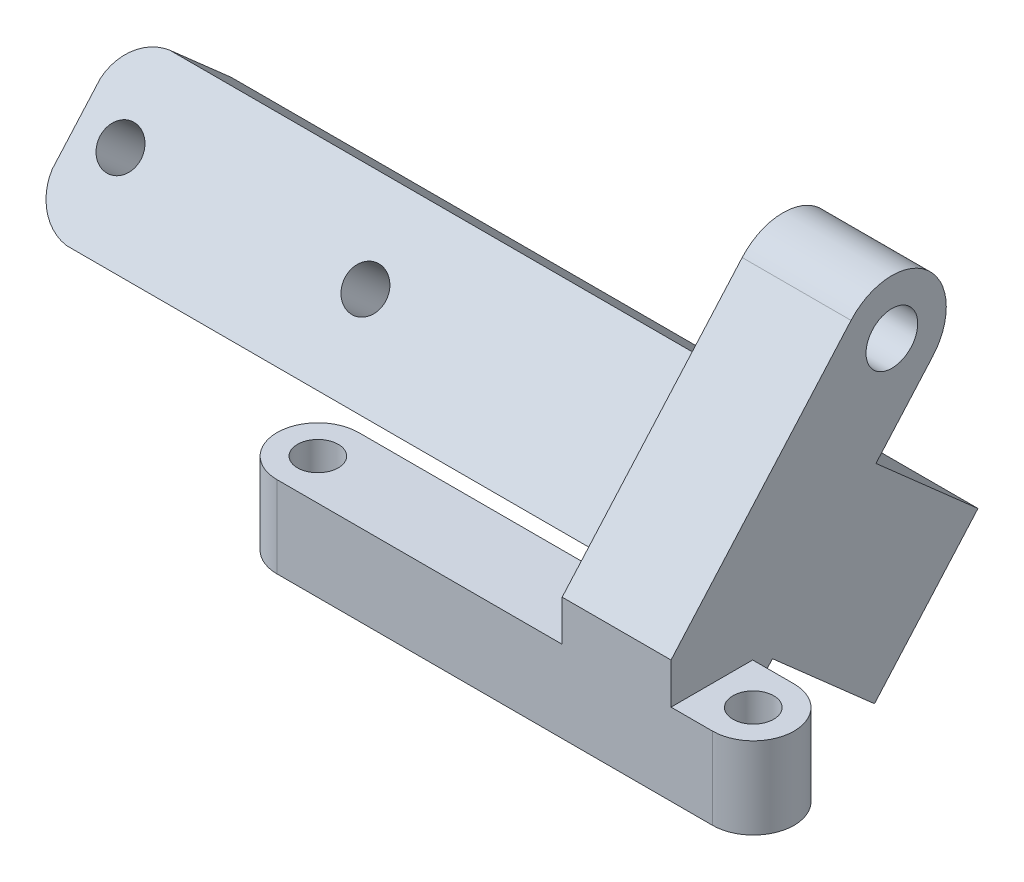
from build123d import *

# Parameters (mm, degrees)
SKETCH_1_R          = 1.5
EXTRUDE_2_DEPTH     = 6
SKETCH_1_4_W        = 8
SKETCH_1_4_H        = 6
EXTRUDE_3_DEPTH     = 3
EXTRUDE_28_DEPTH    = 8
SKETCH_4_W          = 7.960549586
SKETCH_4_H          = 11.5
EXTRUDE_29_DEPTH    = 10
EXTRUDE_30_DEPTH    = 50
SKETCH_7_R          = 1.5
CUT_EXTRUDE_1_DEPTH = 10
SKETCH_8_R          = 1.9
CUT_EXTRUDE_2_DEPTH = 19


with BuildPart() as part:
    # 草圖1 → 填料-伸長2 (new body)
    with BuildSketch(Plane(origin=(0, 0, 0), x_dir=(1, 0, 0), z_dir=(0, 1, 0))):
        with BuildLine():
            Line((-38.676968887, -3), (-6.676968887, -3))
            ThreePointArc((-6.676968887, -3), (-3.676968887, 0), (-6.676968887, 3))
            Line((-6.676968887, 3), (-38.676968887, 3))
            ThreePointArc((-38.676968887, 3), (-41.676968887, 0), (-38.676968887, -3))
        make_face()
        with Locations((-38.676968887, 0)):
            Circle(SKETCH_1_R, mode=Mode.SUBTRACT)
        with Locations((-6.676968887, 0)):
            Circle(SKETCH_1_R, mode=Mode.SUBTRACT)
    extrude(amount=-EXTRUDE_2_DEPTH)

    # 草圖1<4> → 填料-伸長3 (add)
    with BuildSketch(Plane(origin=(0, 0, 0), x_dir=(1, 0, 0), z_dir=(0, 1, 0))):
        with Locations((-13.722758256, 0)):
            Rectangle(SKETCH_1_4_W, SKETCH_1_4_H)
    extrude(amount=EXTRUDE_3_DEPTH)

    # 草圖3 → 填料-伸長28 (add)
    with BuildSketch(Plane(origin=(-9.722758256, 0, 0), x_dir=(0, 0, -1), z_dir=(1, 0, 0))):
        with BuildLine():
            Line((3, -2.291502622), (16.228756555, 12.708497378))
            ThreePointArc((16.228756555, 12.708497378), (15.874507866, 18.354248689), (10.228756555, 18))
            Line((10.228756555, 18), (-3, 3))
            Line((-3, 3), (3, -2.291502622))
        make_face()
    extrude(amount=-EXTRUDE_28_DEPTH)

    # 草圖4 → 填料-伸長29 (add)
    with BuildSketch(Plane(origin=(0, -2.49076751, -2.824264888), x_dir=(-1, 0, 0), z_dir=(0, -0.6614378277661491, -0.7499999999999987))):
        with Locations((13.703033049, 8.211179299)):
            Rectangle(SKETCH_4_W, SKETCH_4_H)
    extrude(amount=EXTRUDE_29_DEPTH)

    # 草圖6 → 填料-伸長30 (add)
    with BuildSketch(Plane.ZY.offset(17.683307842)):
        Polygon((-19.558716996, 1.365738687), (-11.952181977, -7.259261313), (-7.452181977, -3.290634347), (-15.058716996, 5.334365653), align=None)
    extrude(amount=EXTRUDE_30_DEPTH)

    # 草圖7 → 除料-伸長1 (cut)
    with BuildSketch(Plane(origin=(0, -9.105145787, -10.324264888), x_dir=(-1, 0, 0), z_dir=(0, -0.6614378277661491, -0.7499999999999987))):
        with BuildLine():
            Line((64.603588297, 2.461179299), (67.683307842, 2.461179299))
            Line((67.683307842, 2.461179299), (67.683307842, 5.540898844))
            ThreePointArc((67.683307842, 5.540898844), (66.684672199, 3.459814942), (64.603588297, 2.461179299))
        make_face()
        with Locations((64.480624333, 8.278010001)):
            Circle(SKETCH_7_R)
        with BuildLine():
            ThreePointArc((64.603588297, 13.961179299), (66.684672199, 12.962543656), (67.683307842, 10.881459754))
            Line((67.683307842, 10.881459754), (67.683307842, 13.961179299))
            Line((67.683307842, 13.961179299), (64.603588297, 13.961179299))
        make_face()
        with Locations((46.480624333, 8.278010001)):
            Circle(SKETCH_7_R)
    extrude(amount=-CUT_EXTRUDE_1_DEPTH, mode=Mode.SUBTRACT)

    # 草圖8 → 除料-伸長2 (cut)
    with BuildSketch(Plane(origin=(-9.722758256, 0, 0), x_dir=(0, 0, -1), z_dir=(1, 0, 0))):
        with Locations((13.228756555, 15.354248689)):
            Circle(SKETCH_8_R)
    extrude(amount=-CUT_EXTRUDE_2_DEPTH, mode=Mode.SUBTRACT)


solid = part.part
